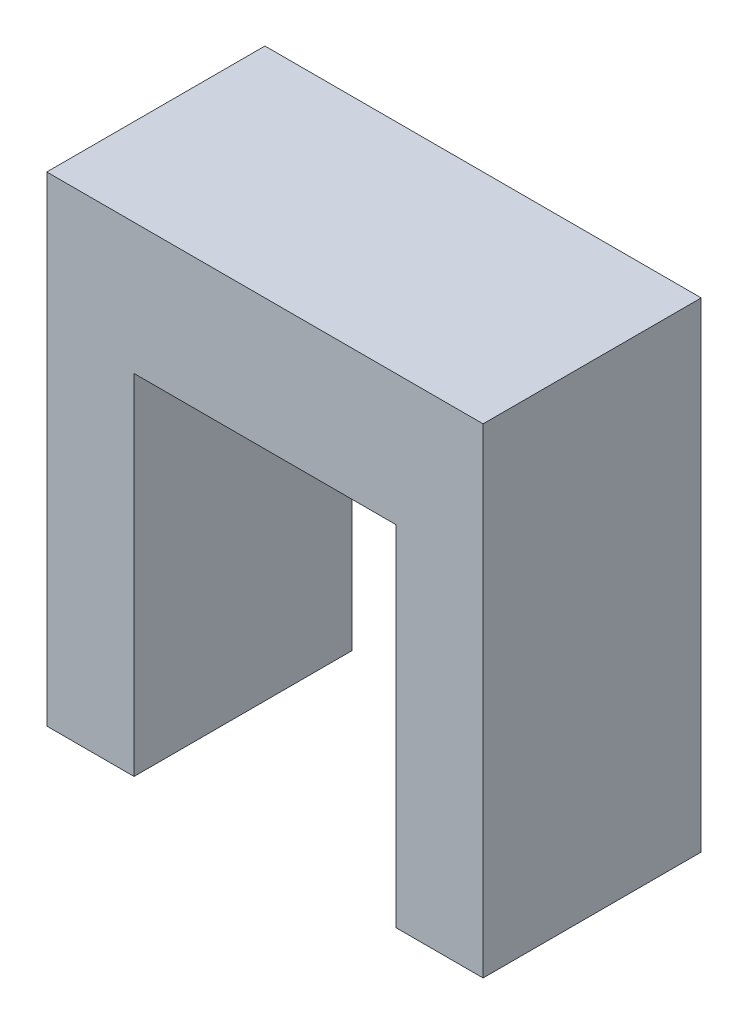
from build123d import *

# Parameters (mm, degrees)
SKETCH1_W           = 50
SKETCH1_H           = 15
BOSS_EXTRUDE1_DEPTH = 25
SKETCH2_W           = 10
SKETCH2_H           = 41
BOSS_EXTRUDE2_DEPTH = 25
SKETCH3_W           = 10
SKETCH3_H           = 41
BOSS_EXTRUDE3_DEPTH = 25


with BuildPart() as part:
    # Sketch1 → Boss-Extrude1 (new body)
    with BuildSketch(Plane.XY):
        with Locations((0, 7.5)):
            Rectangle(SKETCH1_W, SKETCH1_H)
    extrude(amount=BOSS_EXTRUDE1_DEPTH)

    # Sketch2 → Boss-Extrude2 (add)
    with BuildSketch(Plane.XY):
        with Locations((-20, -19.5)):
            Rectangle(SKETCH2_W, SKETCH2_H)
    extrude(amount=BOSS_EXTRUDE2_DEPTH)

    # Sketch3 → Boss-Extrude3 (add)
    with BuildSketch(Plane.XY):
        with Locations((20, -19.5)):
            Rectangle(SKETCH3_W, SKETCH3_H)
    extrude(amount=BOSS_EXTRUDE3_DEPTH)


solid = part.part
